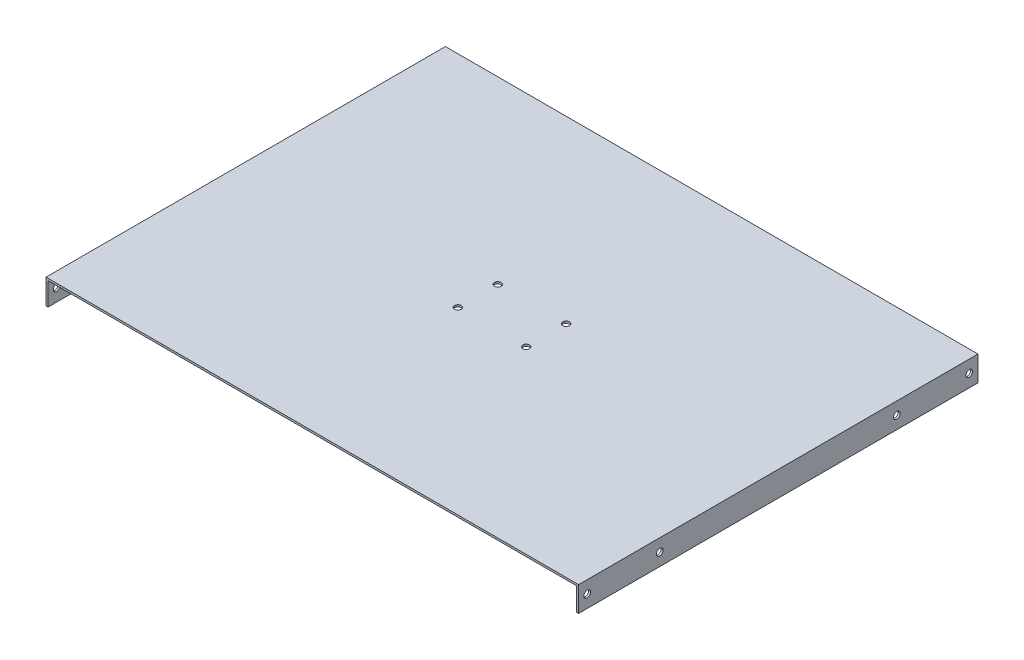
from build123d import *

# Parameters (mm, degrees)
ESBO_O1_W                  = 320
ESBO_O1_H                  = 240
RESSALTO_EXTRUS_O1_DEPTH   = 15
ESBO_O2_W                  = 317.6
ESBO_O2_H                  = 240
CORTE_EXTRUS_O1_DEPTH      = 13.8
CORTE_EXTRUS_O2_START      = 10
ESBO_O3_R                  = 2
CORTE_EXTRUS_O2_DEPTH      = 13.8
CORTE_EXTRUS_O3_DEPTH      = 170
CORTE_EXTRUS_O3_DEPTH_BACK = 170
ESBO_O4_R                  = 2


with BuildPart() as part:
    # Esboço1 → Ressalto-extrusão1 (new body)
    with BuildSketch(Plane(origin=(0, 0, 0), x_dir=(1, 0, 0), z_dir=(0, 1, 0))):
        Rectangle(ESBO_O1_W, ESBO_O1_H)
    extrude(amount=RESSALTO_EXTRUS_O1_DEPTH)

    # Esboço2 → Corte-extrusão1 (cut)
    with BuildSketch(Plane(origin=(0, 0, 0), x_dir=(1, 0, 0), z_dir=(0, 1, 0))):
        Rectangle(ESBO_O2_W, ESBO_O2_H)
    extrude(amount=CORTE_EXTRUS_O1_DEPTH, mode=Mode.SUBTRACT)

    # Esboço3 → Corte-extrusão2 (cut)
    with BuildSketch(Plane(origin=(0, 0, 0), x_dir=(1, 0, 0), z_dir=(0, 1, 0)).offset(CORTE_EXTRUS_O2_START)):
        with Locations(Location((-20.52, -12, 0), (0, 0, 90))):
            Circle(ESBO_O3_R)
        with Locations(Location((20.52, -12, 0), (0, 0, 90))):
            Circle(ESBO_O3_R)
        with Locations(Location((20.52, 12, 0), (0, 0, 90))):
            Circle(ESBO_O3_R)
        with Locations(Location((-20.52, 12, 0), (0, 0, 90))):
            Circle(ESBO_O3_R)
    extrude(amount=CORTE_EXTRUS_O2_DEPTH, mode=Mode.SUBTRACT)

    # Esboço4 → Corte-extrusão3 (cut, two sides: drawn at the far end of the back side and taken through both)
    with BuildSketch(Plane(origin=(0, 0, 0), x_dir=(0, 0, -1), z_dir=(1, 0, 0)).offset(-CORTE_EXTRUS_O3_DEPTH_BACK)):
        with Locations((114.8, 7.5)):
            Circle(ESBO_O4_R)
        with Locations((71.2, 7.5)):
            Circle(ESBO_O4_R)
        with Locations((-114.8, 7.5)):
            Circle(ESBO_O4_R)
        with Locations((-71.2, 7.5)):
            Circle(ESBO_O4_R)
    extrude(amount=CORTE_EXTRUS_O3_DEPTH + CORTE_EXTRUS_O3_DEPTH_BACK, mode=Mode.SUBTRACT)


solid = part.part
